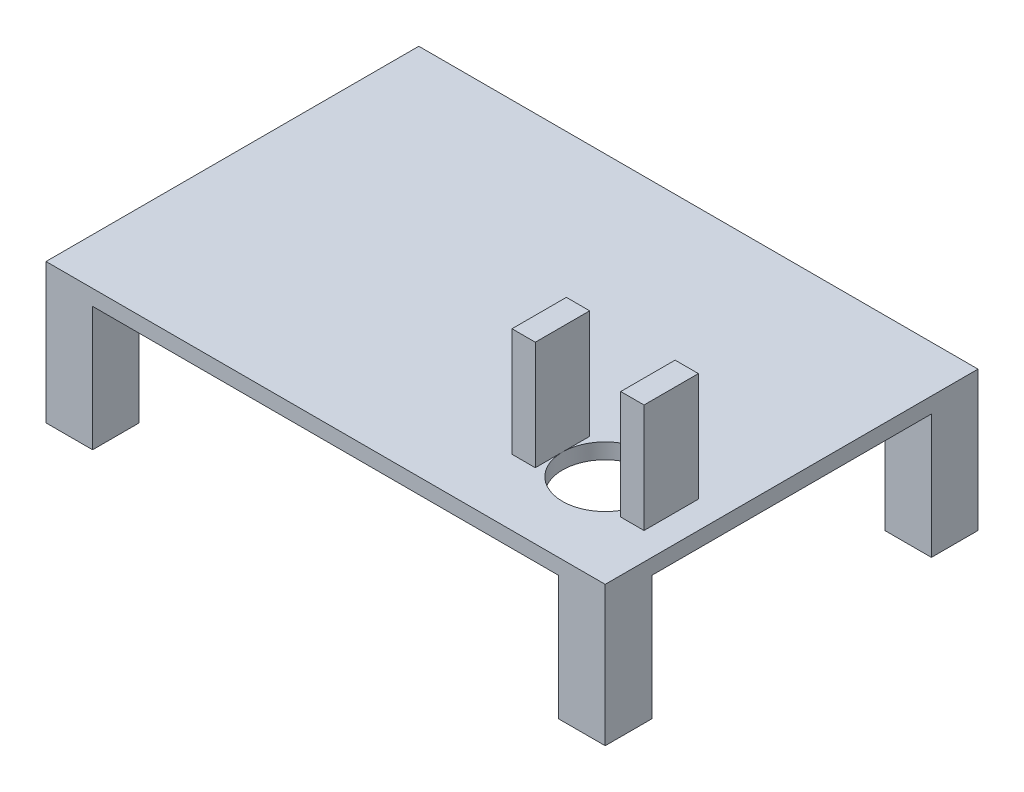
from build123d import *

# Parameters (mm, degrees)
SKETCH1_W           = 914.4
SKETCH1_H           = 609.6
BOSS_EXTRUDE2_DEPTH = 25.4
SKETCH1_3_R         = 69.85
CUT_EXTRUDE2_DEPTH  = 1100.265518426
SKETCH1_4_W         = 38.1
SKETCH1_4_H         = 88.9
BOSS_EXTRUDE3_DEPTH = 203.2
SKETCH3_W           = 76.2
SKETCH3_H           = 76.2
BOSS_EXTRUDE4_DEPTH = 203.2


with BuildPart() as part:
    # Sketch1 → Boss-Extrude2 (new body)
    with BuildSketch(Plane(origin=(0, 0, 0), x_dir=(1, 0, 0), z_dir=(0, 1, 0))):
        with Locations((457.2, 304.8)):
            Rectangle(SKETCH1_W, SKETCH1_H)
    extrude(amount=BOSS_EXTRUDE2_DEPTH)

    # Sketch1<3> → Cut-Extrude2 (cut, through all)
    with BuildSketch(Plane(origin=(0, 0, 0), x_dir=(1, 0, 0), z_dir=(0, 1, 0))):
        with Locations((762, 152.4)):
            Circle(SKETCH1_3_R)
    extrude(amount=CUT_EXTRUDE2_DEPTH, mode=Mode.SUBTRACT)

    # Sketch1<4> → Boss-Extrude3 (add)
    with BuildSketch(Plane(origin=(0, 0, 0), x_dir=(1, 0, 0), z_dir=(0, 1, 0))):
        with Locations((673.1, 152.4)):
            Rectangle(SKETCH1_4_W, SKETCH1_4_H)
        with Locations((850.9, 152.4)):
            Rectangle(SKETCH1_4_W, SKETCH1_4_H)
    extrude(amount=BOSS_EXTRUDE3_DEPTH)

    # Sketch3 → Boss-Extrude4 (add)
    with BuildSketch(Plane.XZ):
        with Locations((38.1, -571.5)):
            Rectangle(SKETCH3_W, SKETCH3_H)
        with Locations((38.1, -38.1)):
            Rectangle(SKETCH3_W, SKETCH3_H)
        with Locations((876.3, -571.5)):
            Rectangle(SKETCH3_W, SKETCH3_H)
        with Locations((876.3, -38.1)):
            Rectangle(SKETCH3_W, SKETCH3_H)
    extrude(amount=BOSS_EXTRUDE4_DEPTH)


solid = part.part
